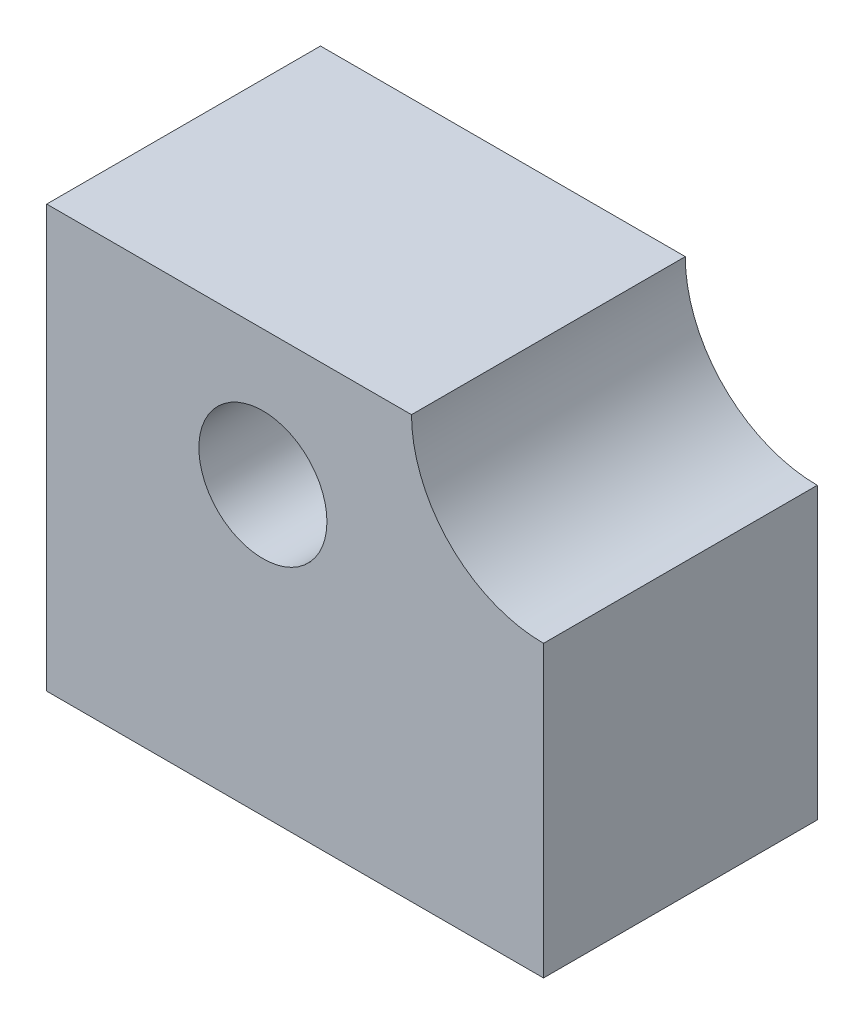
from build123d import *

# Parameters (mm, degrees)
SKETCH_2_W          = 58.070394214
SKETCH_2_H          = 49.309774398
EXTRUDE_1_DEPTH     = 32
SKETCH_3_R          = 7.484005987
SKETCH_3_R_2        = 15.431728179
CUT_EXTRUDE_1_DEPTH = 32


with BuildPart() as part:
    # 草图2 → 凸台-拉伸1 (new body)
    with BuildSketch(Plane.XY):
        with Locations((-2.25273081, 5.756978737)):
            Rectangle(SKETCH_2_W, SKETCH_2_H)
    extrude(amount=EXTRUDE_1_DEPTH)

    # 草图3 → 切除-拉伸1 (cut)
    with BuildSketch(Plane.XY.offset(32)):
        with Locations((-6.017950138, 14.636001798)):
            Circle(SKETCH_3_R)
        with Locations((26.782466297, 30.411865936)):
            Circle(SKETCH_3_R_2)
    extrude(amount=-CUT_EXTRUDE_1_DEPTH, mode=Mode.SUBTRACT)


solid = part.part
